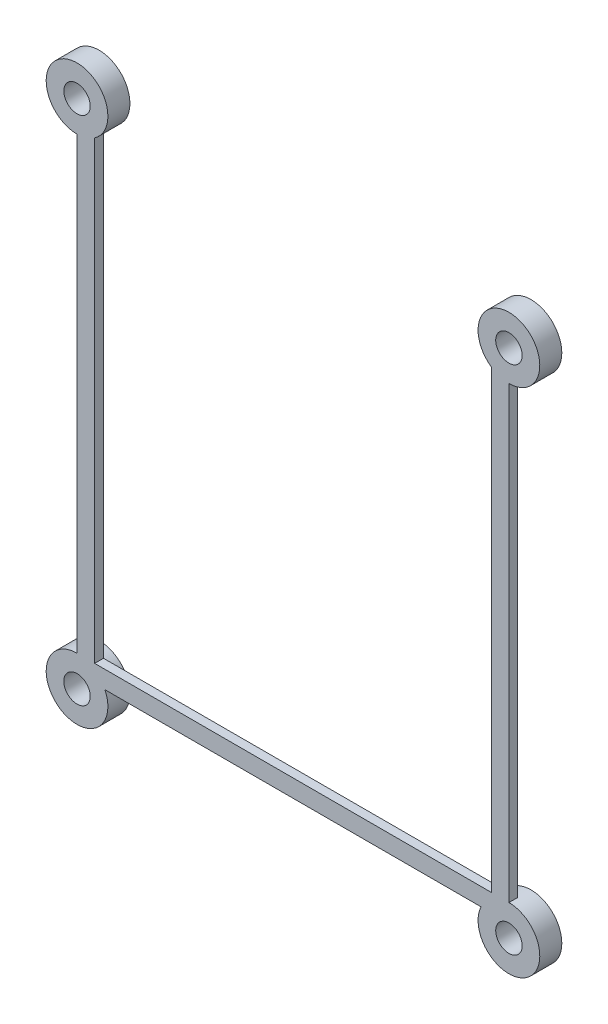
from build123d import *

# Parameters (mm, degrees)
ESQUISSE1_R          = 3.5
ESQUISSE1_R_2        = 1.5
BOSS_EXTRU_2_DEPTH   = 2.5
BOSS_EXTRU_2_2_DEPTH = 2.5
BOSS_EXTRU_2_3_DEPTH = 2.5
BOSS_EXTRU_2_4_DEPTH = 2.5
BOSS_EXTRU_3_DEPTH   = 1


with BuildPart() as part:
    # Esquisse1 → Boss.-Extru.2 (new body)
    with BuildSketch(Plane.XY):
        with Locations((-24.5, 29)):
            Circle(ESQUISSE1_R)
        with Locations((-24.5, 29)):
            Circle(ESQUISSE1_R_2, mode=Mode.SUBTRACT)
    extrude(amount=BOSS_EXTRU_2_DEPTH)



with BuildPart() as body_2:
    # Esquisse1 → Boss.-Extru.2 2 (new body)
    with BuildSketch(Plane.XY):
        with Locations((24.5, 29)):
            Circle(ESQUISSE1_R)
        with Locations((24.5, 29)):
            Circle(ESQUISSE1_R_2, mode=Mode.SUBTRACT)
    extrude(amount=BOSS_EXTRU_2_2_DEPTH)


with BuildPart() as body_3:
    # Esquisse1 → Boss.-Extru.2 3 (new body)
    with BuildSketch(Plane.XY):
        with Locations((-24.5, -29)):
            Circle(ESQUISSE1_R)
        with Locations((-24.5, -29)):
            Circle(ESQUISSE1_R_2, mode=Mode.SUBTRACT)
    extrude(amount=BOSS_EXTRU_2_3_DEPTH)


with BuildPart() as body_4:
    # Esquisse1 → Boss.-Extru.2 4 (new body)
    with BuildSketch(Plane.XY):
        with Locations((24.5, -29)):
            Circle(ESQUISSE1_R)
        with Locations((24.5, -29)):
            Circle(ESQUISSE1_R_2, mode=Mode.SUBTRACT)
    extrude(amount=BOSS_EXTRU_2_4_DEPTH)


with BuildPart() as part_1:
    add(part.part)

    add(body_2.part)  # Boss.-Extru.3 merges body 2

    add(body_3.part)  # Boss.-Extru.3 merges body 3

    add(body_4.part)  # Boss.-Extru.3 merges body 4
    # Esquisse3 → Boss.-Extru.3 (add)
    with BuildSketch(Plane.XY.offset(2.5)):
        Polygon((24.5, 27.5), (24.5, -27.5), (-24.5, -27.5), (-24.5, 27.5), (-22.5, 27.5), (-22.5, -25.5), (22.5, -25.5), (22.5, 27.5), align=None)
    extrude(amount=-BOSS_EXTRU_3_DEPTH)


solid = part_1.part
